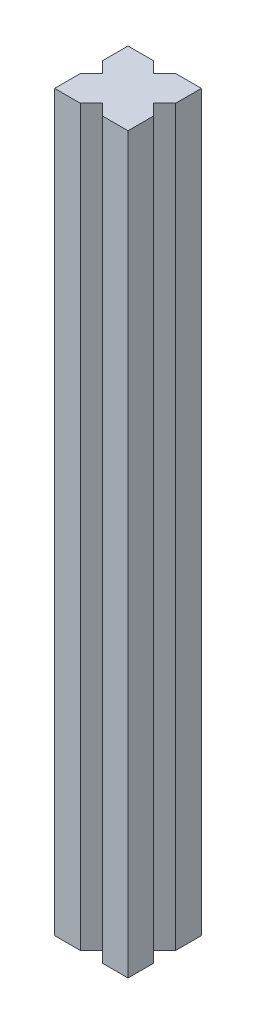
from build123d import *

# Parameters (mm, degrees)
SKIZZE1_W                       = 20
SKIZZE1_H                       = 20
AUFSATZ_LINEAR_AUSTRAGEN1_DEPTH = 200
SCHNITT_LINEAR_AUSTRAGEN1_DEPTH = 202.990098767


with BuildPart() as part:
    # Skizze1 → Aufsatz-Linear austragen1 (new body)
    with BuildSketch(Plane(origin=(0, 0, 0), x_dir=(1, 0, 0), z_dir=(0, 1, 0))):
        with Locations((10, 10)):
            Rectangle(SKIZZE1_W, SKIZZE1_H)
    extrude(amount=AUFSATZ_LINEAR_AUSTRAGEN1_DEPTH)

    # Skizze2 → Schnitt-Linear austragen1 (cut, through all)
    with BuildSketch(Plane(origin=(0, 200, 0), x_dir=(1, 0, 0), z_dir=(0, 1, 0))):
        Polygon((7, 20), (10, 17), (13, 20), align=None)
        Polygon((20, 13), (17, 10), (20, 7), align=None)
        Polygon((0, 7), (0, 13), (3, 10), align=None)
        Polygon((7, 0), (13, 0), (10, 3), align=None)
    extrude(amount=-SCHNITT_LINEAR_AUSTRAGEN1_DEPTH, mode=Mode.SUBTRACT)


solid = part.part
